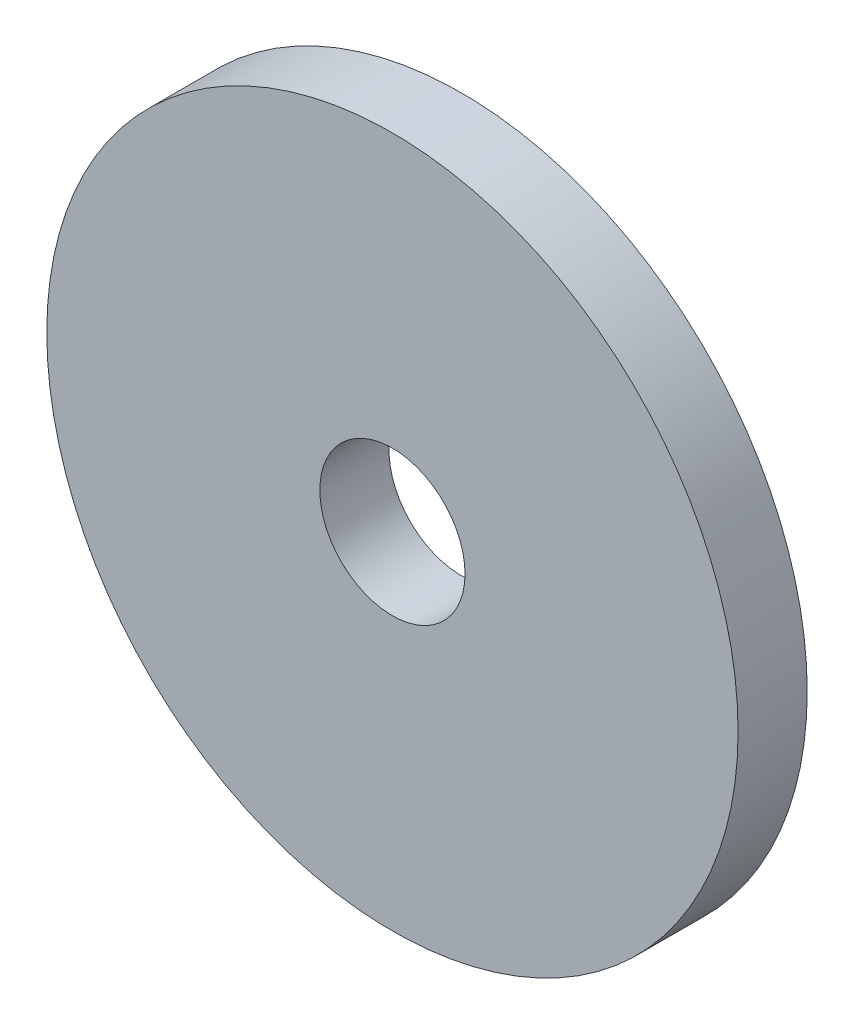
from build123d import *

# Parameters (mm, degrees)
SKETCH1_R      = 25
SKETCH1_R_2    = 5.25
EXTRUDE1_DEPTH = 5


with BuildPart() as part:
    # Sketch1 → Extrude1 (new body)
    with BuildSketch(Plane.XY):
        Circle(SKETCH1_R)
        Circle(SKETCH1_R_2, mode=Mode.SUBTRACT)
    extrude(amount=EXTRUDE1_DEPTH)


solid = part.part
